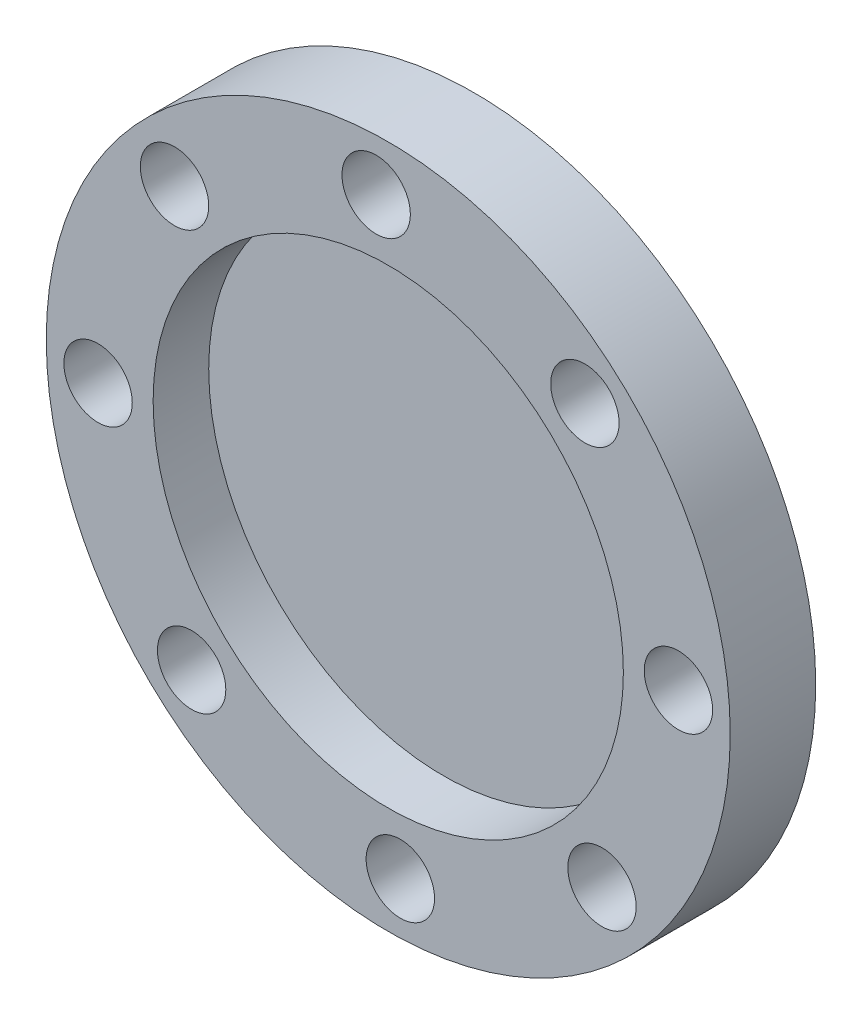
from build123d import *

# Parameters (mm, degrees)
SKETCH1_R           = 40
BOSS_EXTRUDE1_DEPTH = 10
SKETCH2_R           = 27.5
CUT_EXTRUDE1_DEPTH  = 6.5
SKETCH3_R           = 4
CUT_EXTRUDE2_DEPTH  = 58.445626465


with BuildPart() as part:
    # Sketch1 → Boss-Extrude1 (new body)
    with BuildSketch(Plane.XY):
        Circle(SKETCH1_R)
    extrude(amount=BOSS_EXTRUDE1_DEPTH)

    # Sketch2 → Cut-Extrude1 (cut)
    with BuildSketch(Plane.XY.offset(10)):
        Circle(SKETCH2_R)
    extrude(amount=-CUT_EXTRUDE1_DEPTH, mode=Mode.SUBTRACT)

    # Sketch3 → Cut-Extrude2 (cut, through all)
    with BuildSketch(Plane.XY.offset(10)):
        with Locations((-25, 23)):
            Circle(SKETCH3_R)
        with Locations((-1.414213562, 33.941125497)):
            Circle(SKETCH3_R)
        with Locations((23, 25)):
            Circle(SKETCH3_R)
        with Locations((33.941125497, 1.414213562)):
            Circle(SKETCH3_R)
        with Locations((25, -23)):
            Circle(SKETCH3_R)
        with Locations((1.414213562, -33.941125497)):
            Circle(SKETCH3_R)
        with Locations((-23, -25)):
            Circle(SKETCH3_R)
        with Locations((-33.941125497, -1.414213562)):
            Circle(SKETCH3_R)
    extrude(amount=-CUT_EXTRUDE2_DEPTH, mode=Mode.SUBTRACT)


solid = part.part
